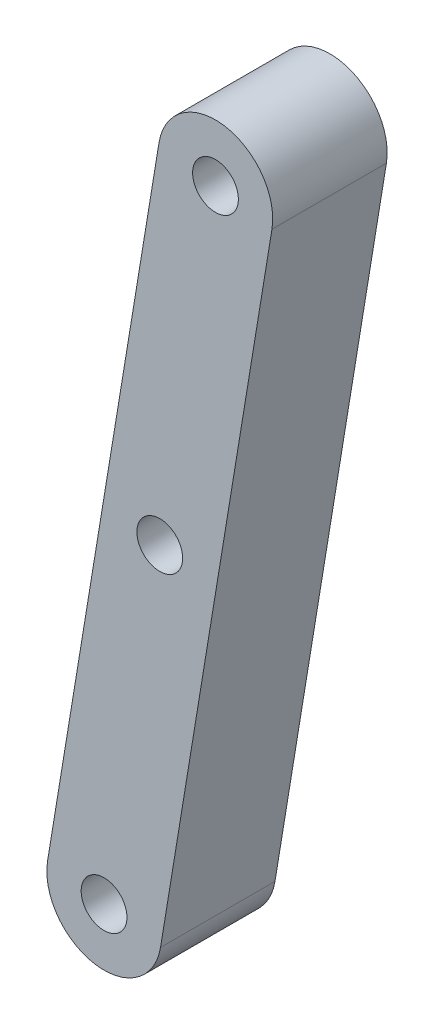
from build123d import *

# Parameters (mm, degrees)
SKETCH1_R           = 2
BOSS_EXTRUDE1_DEPTH = 10


with BuildPart() as part:
    # Sketch1 → Boss-Extrude1 (new body)
    with BuildSketch(Plane.XY):
        with BuildLine():
            Line((-5.199461874, 20.01628807), (-14.93375806, -39.188808651))
            ThreePointArc((-14.93375806, -39.188808651), (-10.811191349, -44.93375806), (-5.06624194, -40.811191349))
            Line((-5.06624194, -40.811191349), (4.668054246, 18.393905372))
            ThreePointArc((4.668054246, 18.393905372), (0.545487535, 24.138854781), (-5.199461874, 20.01628807))
        make_face()
        with Locations((-10, -40)):
            Circle(SKETCH1_R, mode=Mode.SUBTRACT)
        with Locations((-5.132851907, -10.397451639)):
            Circle(SKETCH1_R, mode=Mode.SUBTRACT)
        with Locations((-0.265703814, 19.205096721)):
            Circle(SKETCH1_R, mode=Mode.SUBTRACT)
    extrude(amount=BOSS_EXTRUDE1_DEPTH)


solid = part.part
